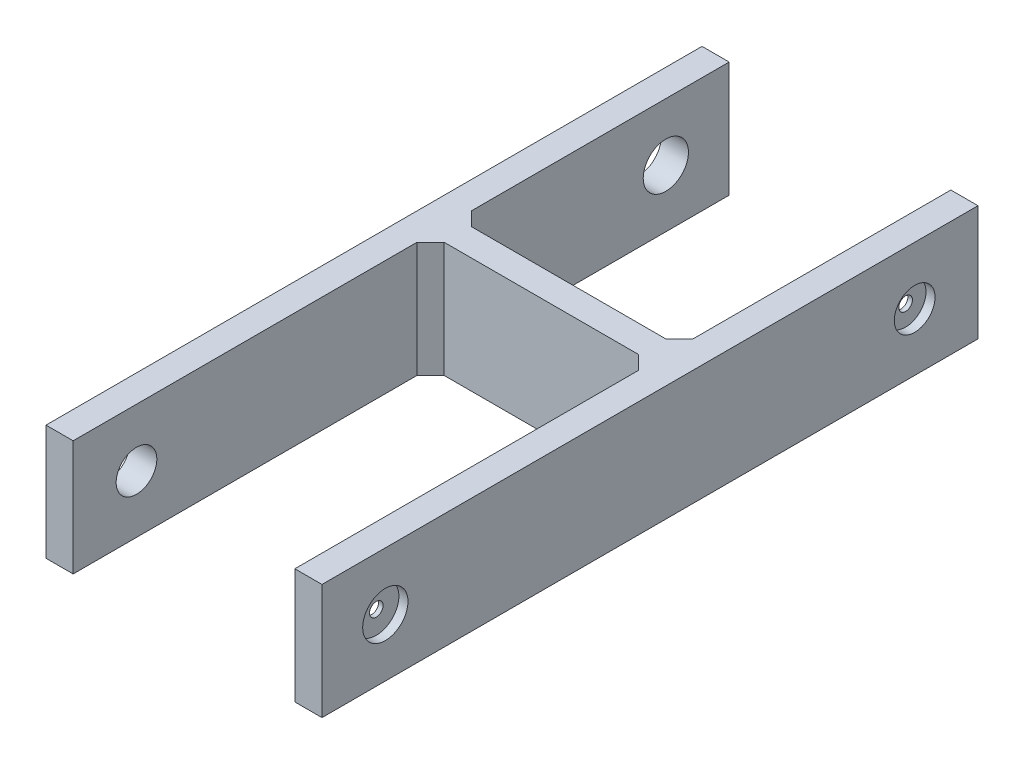
from build123d import *

# Parameters (mm, degrees)
BOSS_EXTRUDE1_DEPTH     = 25.5
SKETCH2_R               = 4.5
CUT_EXTRUDE1_DEPTH      = 25
SKETCH3_R               = 1.5
CUT_EXTRUDE2_DEPTH      = 10
SKETCH4_R               = 5
CUT_EXTRUDE3_DEPTH      = 2
CUT_EXTRUDE4_DEPTH      = 3
CUT_EXTRUDE5_DEPTH      = 3
SKETCH7_R               = 4.5
CUT_EXTRUDE6_DEPTH      = 2
CUT_EXTRUDE7_DEPTH      = 108.685885798
CUT_EXTRUDE7_DEPTH_BACK = 108.685885798
SKETCH8_R               = 1.5
SKETCH9_R               = 5
CUT_EXTRUDE8_DEPTH      = 10
BOSS_EXTRUDE2_DEPTH     = 25.5


with BuildPart() as part:
    # Sketch1 → Boss-Extrude1 (new body)
    with BuildSketch(Plane(origin=(0, 0, 0), x_dir=(1, 0, 0), z_dir=(0, 1, 0))):
        Polygon((6, -6), (55, -6), (55, -85), (61, -85), (61, 60), (55, 60), (55, 0), (6, 0), (6, 60), (0, 60), (0, -85), (6, -85), align=None)
    extrude(amount=BOSS_EXTRUDE1_DEPTH)

    # Sketch2 → Cut-Extrude1 (cut)
    with BuildSketch(Plane(origin=(6, 0, 0), x_dir=(0, 0, -1), z_dir=(1, 0, 0))):
        with Locations((-71, 12.75)):
            Circle(SKETCH2_R)
    extrude(amount=-CUT_EXTRUDE1_DEPTH, mode=Mode.SUBTRACT)

    # Sketch3 → Cut-Extrude2 (cut)
    with BuildSketch(Plane.ZY.offset(-55)):
        with Locations((71, 12.75)):
            Circle(SKETCH3_R)
    extrude(amount=-CUT_EXTRUDE2_DEPTH, mode=Mode.SUBTRACT)

    # Sketch4 → Cut-Extrude3 (cut)
    with BuildSketch(Plane(origin=(61, 0, 0), x_dir=(0, 0, -1), z_dir=(1, 0, 0))):
        with Locations((-71, 12.75)):
            Circle(SKETCH4_R)
    extrude(amount=-CUT_EXTRUDE3_DEPTH, mode=Mode.SUBTRACT)

    # Sketch5 → Cut-Extrude4 (cut)
    with BuildSketch(Plane.ZY.offset(-55)):
        with BuildLine():
            Line((71, 19.25), (54, 15.75))
            ThreePointArc((54, 15.75), (51, 12.75), (54, 9.75))
            Line((54, 9.75), (71, 6.25))
            ThreePointArc((71, 6.25), (77.5, 12.75), (71, 19.25))
        make_face()
    extrude(amount=-CUT_EXTRUDE4_DEPTH, mode=Mode.SUBTRACT)

    # Sketch6 → Cut-Extrude5 (cut)
    with BuildSketch(Plane.ZY.offset(-55)):
        with BuildLine():
            Line((-29, 9.75), (-46, 6.25))
            ThreePointArc((-46, 6.25), (-52.5, 12.75), (-46, 19.25))
            Line((-46, 19.25), (-29, 15.75))
            ThreePointArc((-29, 15.75), (-26, 12.75), (-29, 9.75))
        make_face()
    extrude(amount=-CUT_EXTRUDE5_DEPTH, mode=Mode.SUBTRACT)

    # Sketch7 → Cut-Extrude6 (cut)
    with BuildSketch(Plane(origin=(61, 0, 0), x_dir=(0, 0, -1), z_dir=(1, 0, 0))):
        with Locations((46, 12.75)):
            Circle(SKETCH7_R)
    extrude(amount=-CUT_EXTRUDE6_DEPTH, mode=Mode.SUBTRACT)

    # Sketch8 → Cut-Extrude7 (cut, two sides: drawn at the far end of the back side and taken through both)
    with BuildSketch(Plane(origin=(61, 0, 0), x_dir=(0, 0, -1), z_dir=(1, 0, 0)).offset(-CUT_EXTRUDE7_DEPTH_BACK)):
        with Locations((46, 12.75)):
            Circle(SKETCH8_R)
    extrude(amount=CUT_EXTRUDE7_DEPTH + CUT_EXTRUDE7_DEPTH_BACK, mode=Mode.SUBTRACT)

    # Sketch9 → Cut-Extrude8 (cut)
    with BuildSketch(Plane.ZY):
        with Locations((-46, 12.75)):
            Circle(SKETCH9_R)
    extrude(amount=-CUT_EXTRUDE8_DEPTH, mode=Mode.SUBTRACT)

    # Sketch10 → Boss-Extrude2 (add)
    with BuildSketch(Plane(origin=(0, 25.5, 0), x_dir=(1, 0, 0), z_dir=(0, 1, 0))):
        Polygon((9, -6), (6, -6), (6, -9), align=None)
        Polygon((6, 0), (6, 3), (9, 0), align=None)
        Polygon((52, 0), (55, 0), (55, 3), align=None)
        Polygon((55, -6), (55, -9), (52, -6), align=None)
    extrude(amount=-BOSS_EXTRUDE2_DEPTH)


solid = part.part
